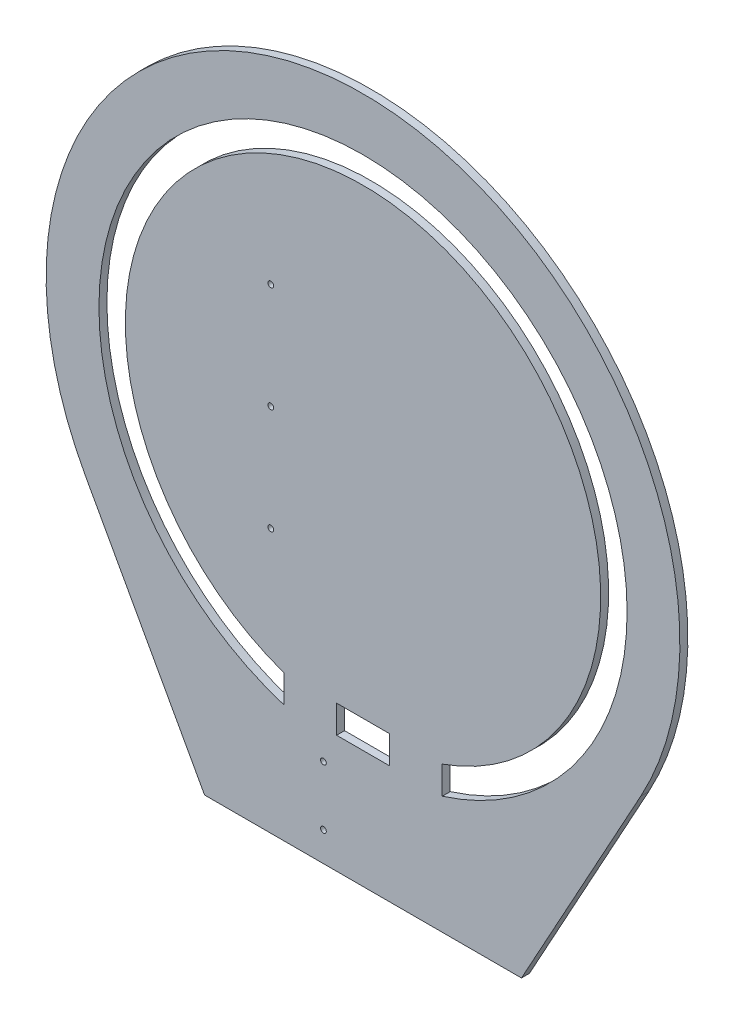
from build123d import *

# Parameters (mm, degrees)
SKETCH1_R           = 0.27178
BOSS_EXTRUDE1_DEPTH = 0.75438


with BuildPart() as part:
    # Sketch1 → Boss-Extrude1 (new body)
    with BuildSketch(Plane.XY):
        with BuildLine():
            Line((-26.292884648, -14.44590658), (-15, -35))
            Line((-15, -35), (-7.5, -35))
            Line((-7.5, -35), (15, -35))
            Line((15, -35), (26.292884648, -14.44590658))
            ThreePointArc((26.292884648, -14.44590658), (0, 30), (-26.292884648, -14.44590658))
        make_face()
        with Locations((-3.750000002, -32.224240034)):
            Circle(SKETCH1_R, mode=Mode.SUBTRACT)
        with Locations((-3.750000002, -26.624240034)):
            Circle(SKETCH1_R, mode=Mode.SUBTRACT)
        Polygon((2.5, -23.848480035), (-2.5, -23.848480035), (-2.5, -22.360679775), (-2.5, -21.213203436), (2.5, -21.213203436), (2.5, -22.360679775), align=None, mode=Mode.SUBTRACT)
        with Locations((-8.733792148, -10)):
            Circle(SKETCH1_R, mode=Mode.SUBTRACT)
        with Locations((-8.733792148, 0)):
            Circle(SKETCH1_R, mode=Mode.SUBTRACT)
        with BuildLine():
            Line((-7.5, -21.213203436), (-7.5, -23.848480035))
            ThreePointArc((-7.5, -23.848480035), (0, 25), (7.5, -23.848480035))
            Line((7.5, -23.848480035), (7.5, -21.213203436))
            ThreePointArc((7.5, -21.213203436), (0, 22.5), (-7.5, -21.213203436))
        make_face(mode=Mode.SUBTRACT)
        with Locations((-8.733792148, 10)):
            Circle(SKETCH1_R, mode=Mode.SUBTRACT)
    extrude(amount=BOSS_EXTRUDE1_DEPTH)


solid = part.part
